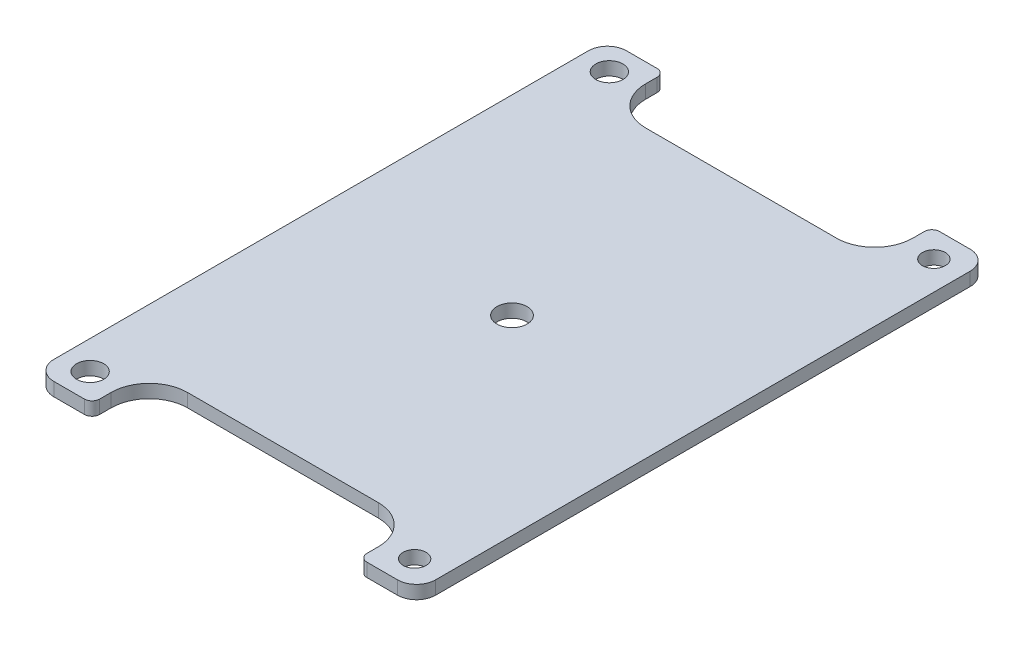
from build123d import *

# Parameters (mm, degrees)
BOSS_EXTRUDE1_DEPTH = 3.5
SKETCH2_R           = 3.96875
SKETCH2_R_2         = 3
SKETCH2_R_3         = 3.54844416
CUT_EXTRUDE3_DEPTH  = 6


with BuildPart() as part:
    # Sketch1 → Boss-Extrude1 (new body)
    with BuildSketch(Plane(origin=(0, 0, 0), x_dir=(1, 0, 0), z_dir=(0, 1, 0))):
        with BuildLine():
            Line((-25, 60), (25, 60))
            ThreePointArc((25, 60), (32.071067812, 62.928932188), (35, 70))
            Line((35, 70), (35, 73))
            ThreePointArc((35, 73), (35.585786438, 74.414213562), (37, 75))
            Line((37, 75), (45, 75))
            ThreePointArc((45, 75), (48.535533906, 73.535533906), (50, 70))
            Line((50, 70), (50, -70))
            ThreePointArc((50, -70), (48.535533906, -73.535533906), (45, -75))
            Line((45, -75), (37, -75))
            ThreePointArc((37, -75), (35.585786438, -74.414213562), (35, -73))
            Line((35, -73), (35, -70))
            ThreePointArc((35, -70), (32.071067812, -62.928932188), (25, -60))
            Line((25, -60), (-25, -60))
            ThreePointArc((-25, -60), (-32.071067812, -62.928932188), (-35, -70))
            Line((-35, -70), (-35, -73))
            ThreePointArc((-35, -73), (-35.585786438, -74.414213562), (-37, -75))
            Line((-37, -75), (-45, -75))
            ThreePointArc((-45, -75), (-48.535533906, -73.535533906), (-50, -70))
            Line((-50, -70), (-50, 70))
            ThreePointArc((-50, 70), (-48.535533906, 73.535533906), (-45, 75))
            Line((-45, 75), (-37, 75))
            ThreePointArc((-37, 75), (-35.585786438, 74.414213562), (-35, 73))
            Line((-35, 73), (-35, 70))
            ThreePointArc((-35, 70), (-32.071067812, 62.928932188), (-25, 60))
        make_face()
    extrude(amount=BOSS_EXTRUDE1_DEPTH)

    # Sketch2 → Cut-Extrude3 (cut)
    with BuildSketch(Plane.XZ):
        with Locations(Location((0, 0, 0), (0, 0, 270))):
            Circle(SKETCH2_R)
        with Locations(Location((42.5, -68, 0), (0, 0, 270))):
            Circle(SKETCH2_R_2)
        with Locations(Location((-42.5, -68, 0), (0, 0, 270))):
            Circle(SKETCH2_R_3)
        with Locations(Location((42.5, 68, 0), (0, 0, 270))):
            Circle(SKETCH2_R_2)
        with Locations(Location((-42.5, 68, 0), (0, 0, 270))):
            Circle(SKETCH2_R_3)
    extrude(amount=-CUT_EXTRUDE3_DEPTH, mode=Mode.SUBTRACT)


solid = part.part
